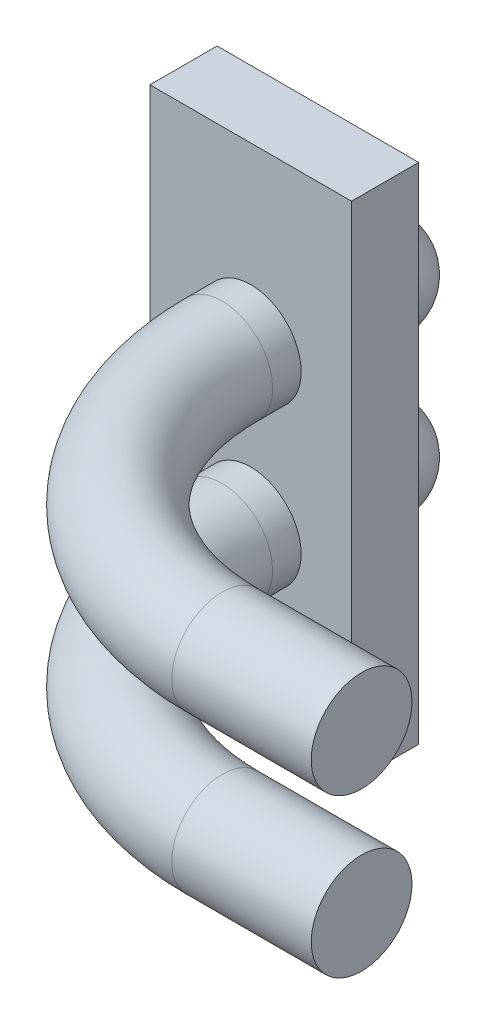
from build123d import *

# Parameters (mm, degrees)
SKETCH1_W           = 6
SKETCH1_H           = 15
BOSS_EXTRUDE1_DEPTH = 2
SKETCH2_R           = 1.5
BOSS_EXTRUDE2_DEPTH = 3
FILLET1_R           = 1.5
SKETCH3_R           = 1.5


with BuildPart() as part:
    # Sketch1 → Boss-Extrude1 (new body)
    with BuildSketch(Plane.XY):
        Rectangle(SKETCH1_W, SKETCH1_H)
    extrude(amount=BOSS_EXTRUDE1_DEPTH)

    # Sketch2 → Boss-Extrude2 (add)
    with BuildSketch(Plane(origin=(0, 0, 0), x_dir=(-1, 0, 0), z_dir=(0, 0, -1))):
        with Locations((0, 2.35)):
            Circle(SKETCH2_R)
        with Locations((0, -2.35)):
            Circle(SKETCH2_R)
    extrude(amount=BOSS_EXTRUDE2_DEPTH)

    # Fillet1
    fillet1_edges = [part.edges().sort_by_distance(p)[0] for p in [
        (1.5, 2.35, -3),
        (1.5, -2.35, -3),
    ]]
    fillet(fillet1_edges, radius=FILLET1_R)

    # Sweep1: sweep along a path in Sketch4
    with BuildLine(Plane(origin=(0, 2.35, 0), x_dir=(-1, 0, 0), z_dir=(0, 1, 0))) as sweep1_path:
        Line((0, 2), (0, 2.85))
        ThreePointArc((0, 2.85), (-2.196699141, 8.153300859), (-7.5, 10.35))
        Line((-7.5, 10.35), (-11.65, 10.35))
    # Sketch3 → Sweep1 (sweep)
    with BuildSketch(Plane.XY.offset(2)):
        with Locations((0, -2.35)):
            Circle(SKETCH3_R)
        with Locations((0, 2.35)):
            Circle(SKETCH3_R)
    sweep(path=sweep1_path.line)


solid = part.part
